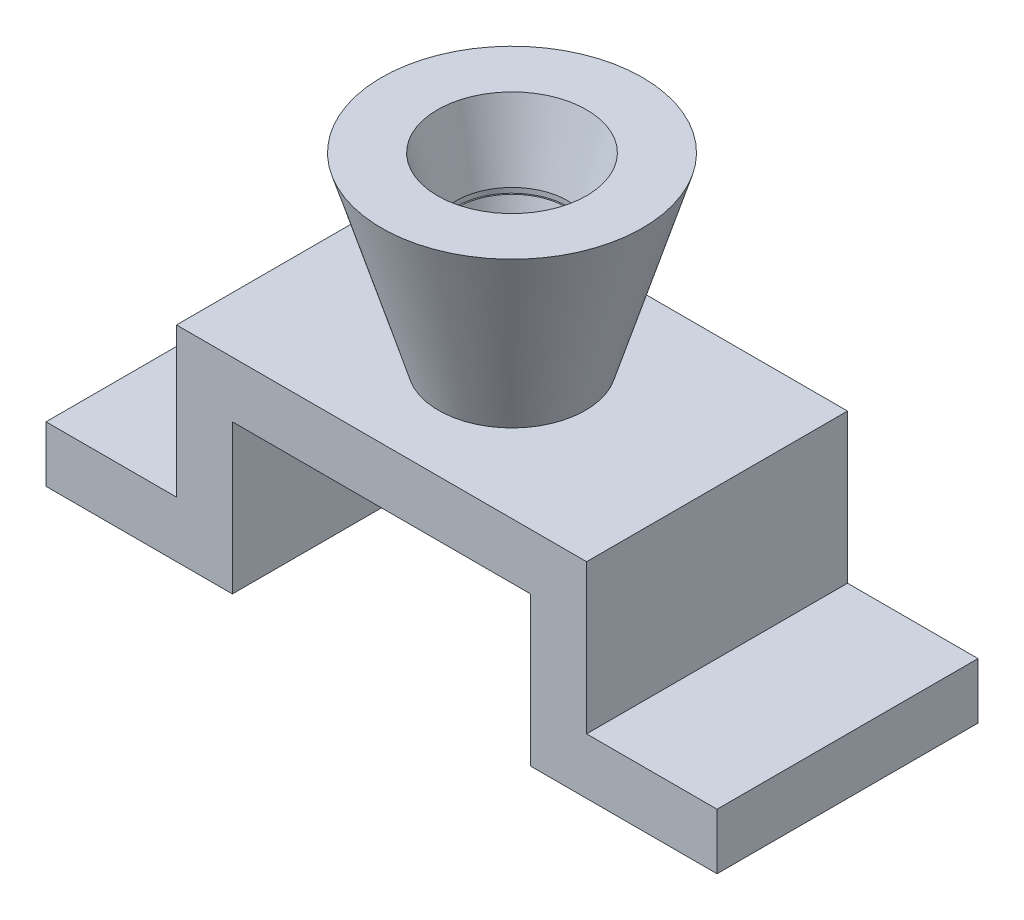
from build123d import *

# Parameters (mm, degrees)
BOSS_EXTRUDE1_DEPTH      = 35
BOSS_EXTRUDE1_DEPTH_BACK = 35
HOLE1_D                  = 30
HOLE1_DEPTH              = 20


with BuildPart() as part:
    # Sketch1 → Boss-Extrude1 (new, two sides: drawn at the far end of the back side and taken through both)
    with BuildSketch(Plane.XY.offset(-BOSS_EXTRUDE1_DEPTH_BACK)):
        Polygon((-90, 0), (-90, 15), (-55, 15), (-55, 55), (55, 55), (55, 15), (90, 15), (90, 0), (40, 0), (40, 40), (-40, 40), (-40, 0), align=None)
    extrude(amount=BOSS_EXTRUDE1_DEPTH + BOSS_EXTRUDE1_DEPTH_BACK)

    # Sketch3 → Revolve1 (revolve)
    with BuildSketch(Plane.XY):
        Polygon((0, 105), (35, 105), (19.713465927, 55), (0, 55), align=None)
    revolve(axis=Axis((0, 0, 0), (0, 1, 0)))

    # Hole1
    with Locations(Plane(origin=(0, 105, 0), x_dir=(1, 0, 0), z_dir=(0, 1, 0))):
        with Locations((0, 0)):
            Hole(HOLE1_D / 2, depth=HOLE1_DEPTH)

    # Sketch7 → Hole2 (revolve, cut)
    with BuildSketch(Plane(origin=(0, 105, 0), x_dir=(0, 0, 1), z_dir=(1, 0, 0))):
        Polygon((0, 0), (0, 69.806884952), (8, 65), (8, 44.784609691), (20, 0), align=None)
    revolve(axis=Axis((0, 119.308894879, 0), (0, -1, 0)), mode=Mode.SUBTRACT)


solid = part.part
